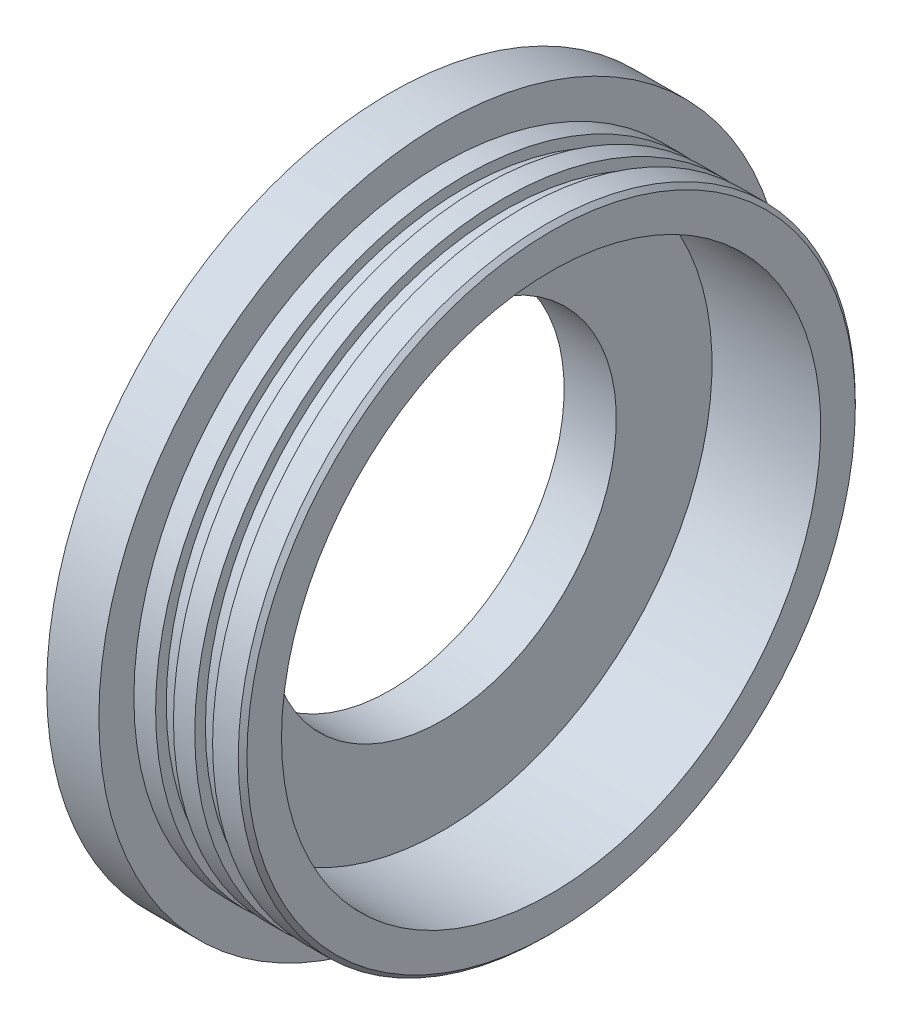
from build123d import *

# Parameters (mm, degrees)
CHAMFER_988_SIZE          = 1
SKETCH_2_W                = 4.1
SKETCH_2_H                = 2.45
PATTERN_LINEAR_O_2_COUNT  = 2
PATTERN_LINEAR_O_2_PITCH  = 9
SKETCH_3_W                = 2.4
SKETCH_3_H                = 4.1
PATTERN_CIRCULAR_M4_COUNT = 6


with BuildPart() as part:
    # ｽｹｯﾁ1 → Revolve 949 (revolve)
    with BuildSketch(Plane.XY):
        Polygon((-12, 40), (-12, 79), (0, 79), (0, 70.95), (25, 70.95), (25, 62), (0, 62), (0, 40), align=None)
    revolve(axis=Axis((0, 0, 0), (1, 0, 0)))

    # Chamfer 988
    chamfer_988_edges = [part.edges().sort_by_distance(p)[0] for p in [
        (25, -70.95, 0),
    ]]
    chamfer(chamfer_988_edges, length=CHAMFER_988_SIZE)

    # ｽｹｯﾁ2 → Oリング溝入れ G-135 (revolve, cut)
    with BuildSketch(Plane.XY):
        with Locations((7.05, 69.725)):
            Rectangle(SKETCH_2_W, SKETCH_2_H)
    o_g_135 = revolve(axis=Axis((0, 0, 0), (1, 0, 0)), mode=Mode.SUBTRACT)

    # Oリング溝 2 本目: Oリング溝入れ G-135 ×2
    with Locations(*[(i * PATTERN_LINEAR_O_2_PITCH, 0, 0) for i in range(1, PATTERN_LINEAR_O_2_COUNT)]):
        add(o_g_135, mode=Mode.SUBTRACT)

    # ｽｹｯﾁ3 → 窓 Oリング溝入れ G-85 (revolve, cut)
    with BuildSketch(Plane.XY):
        with Locations((-10.8, 44.55)):
            Rectangle(SKETCH_3_W, SKETCH_3_H)
    revolve(axis=Axis((0, 0, 0), (1, 0, 0)), mode=Mode.SUBTRACT)

    # ｽｹｯﾁ4 → M4 めねじ (revolve, cut)
    with BuildSketch(Plane(origin=(-12, 54.25, 0), x_dir=(0, 0, 1), z_dir=(0, 1, 0))):
        Polygon((0, 0), (0, 10.991420021), (1.65, 10), (1.65, 0), align=None)
    hole_wizard_m4 = revolve(axis=Axis((-18.35, 54.25, 0), (1, 0, 0)), mode=Mode.SUBTRACT)

    # M4 めねじ 等配: M4 めねじ ×6 about axis
    pattern_circular_m4_axis = Axis((-14.35, 0, 0), (1, 0, 0))
    for i in range(1, PATTERN_CIRCULAR_M4_COUNT):
        add(hole_wizard_m4.rotate(pattern_circular_m4_axis, i * 360 / PATTERN_CIRCULAR_M4_COUNT), mode=Mode.SUBTRACT)


solid = part.part
